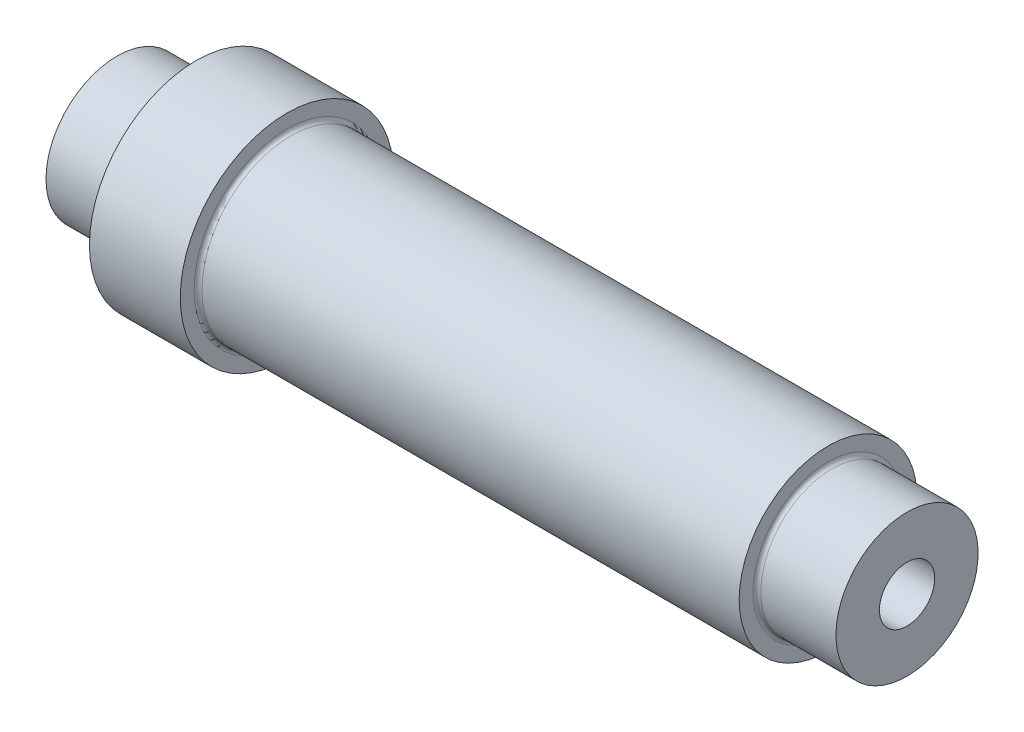
from build123d import *

# Parameters (mm, degrees)
BROCA_DE_ROSQUEAR_PARA_TARRAXA_DE_M161_D       = 14
BROCA_DE_ROSQUEAR_PARA_TARRAXA_DE_M161_DEPTH   = 30
BROCA_DE_ROSQUEAR_PARA_TARRAXA_DE_M161_TIP     = 4.206024333
BROCA_DE_ROSQUEAR_PARA_TARRAXA_DE_M161_O_D     = 14
BROCA_DE_ROSQUEAR_PARA_TARRAXA_DE_M161_O_DEPTH = 30
BROCA_DE_ROSQUEAR_PARA_TARRAXA_DE_M161_O_TIP   = 4.206024333
FILETE1_R                                      = 1


with BuildPart() as part:
    # Esboço1 → Revolução1 (revolve)
    with BuildSketch(Plane.XY, mode=Mode.PRIVATE) as revolu_o1_sk:
        Polygon((0, 0), (0, 18), (20, 18), (20, 27), (43, 27), (43, 22.5), (180, 22.5), (180, 18), (200, 18), (200, 0), align=None)
    revolve(revolu_o1_sk.sketch.rotate(Axis((0, 0, 0), (1, 0, 0)), 90), axis=Axis((0, 0, 0), (1, 0, 0)))

    # Broca de rosquear para tarraxa de M161
    with Locations(Plane(origin=(200, 0, 0), x_dir=(0, 0, 1), z_dir=(1, 0, 0))):
        with Locations((0, 0)):
            Hole(BROCA_DE_ROSQUEAR_PARA_TARRAXA_DE_M161_D / 2, depth=BROCA_DE_ROSQUEAR_PARA_TARRAXA_DE_M161_DEPTH)
            with Locations((0, 0, -(BROCA_DE_ROSQUEAR_PARA_TARRAXA_DE_M161_DEPTH + BROCA_DE_ROSQUEAR_PARA_TARRAXA_DE_M161_TIP / 2))):  # 118° drill point
                Cone(0, BROCA_DE_ROSQUEAR_PARA_TARRAXA_DE_M161_D / 2, BROCA_DE_ROSQUEAR_PARA_TARRAXA_DE_M161_TIP, mode=Mode.SUBTRACT)

    # Broca de rosquear para tarraxa de M161 o
    with Locations(Plane(origin=(0, 0, 0), x_dir=(0, 0, -1), z_dir=(-1, 0, 0))):
        with Locations((0, 0)):
            Hole(BROCA_DE_ROSQUEAR_PARA_TARRAXA_DE_M161_O_D / 2, depth=BROCA_DE_ROSQUEAR_PARA_TARRAXA_DE_M161_O_DEPTH)
            with Locations((0, 0, -(BROCA_DE_ROSQUEAR_PARA_TARRAXA_DE_M161_O_DEPTH + BROCA_DE_ROSQUEAR_PARA_TARRAXA_DE_M161_O_TIP / 2))):  # 118° drill point
                Cone(0, BROCA_DE_ROSQUEAR_PARA_TARRAXA_DE_M161_O_D / 2, BROCA_DE_ROSQUEAR_PARA_TARRAXA_DE_M161_O_TIP, mode=Mode.SUBTRACT)

    # Filete1
    filete1_edges = [part.edges().sort_by_distance(p)[0] for p in [
        (20, 0, -18),
        (180, 0, -18),
        (43, 0, -22.5),
    ]]
    fillet(filete1_edges, radius=FILETE1_R)


solid = part.part
